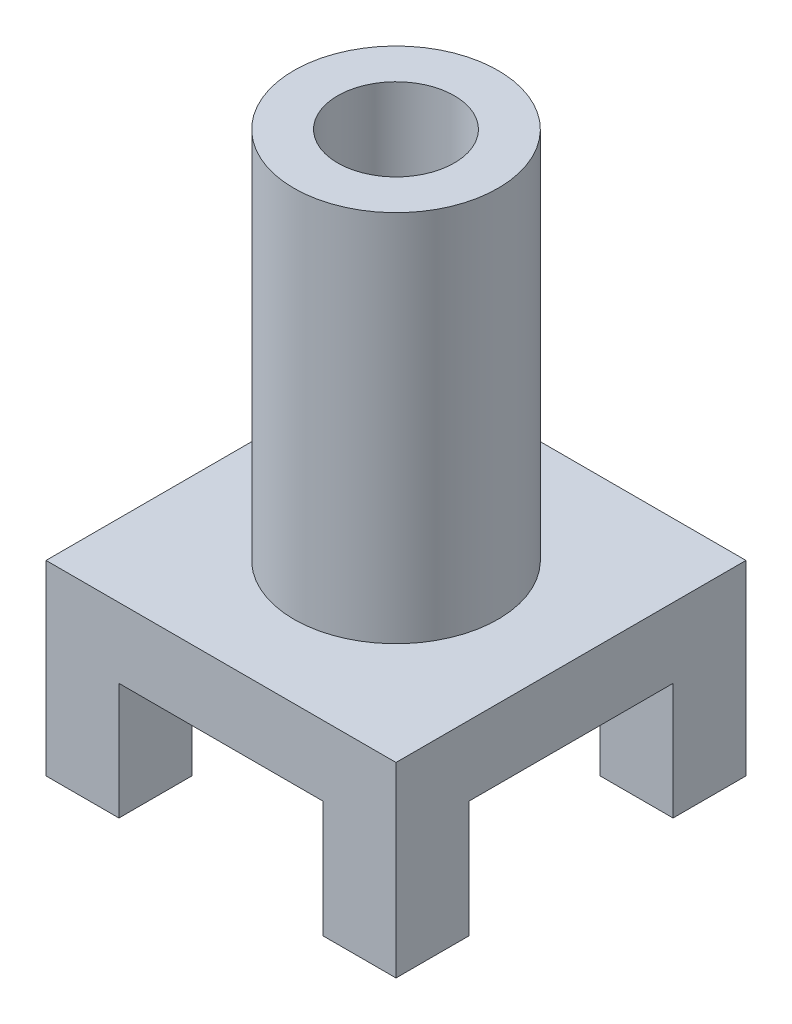
from build123d import *

# Parameters (mm, degrees)
SKETCH1_W           = 60
SKETCH1_H           = 60
BOSS_EXTRUDE1_DEPTH = 32
SKETCH2_W           = 35
SKETCH2_H           = 20
CUT_EXTRUDE2_DEPTH  = 75.323616704
SKETCH4_W           = 35
SKETCH4_H           = 20
CUT_EXTRUDE3_DEPTH  = 75.323616704
SKETCH5_R           = 17.5
BOSS_EXTRUDE2_DEPTH = 64
SKETCH6_R           = 10
CUT_EXTRUDE4_DEPTH  = 105.957134107


with BuildPart() as part:
    # Sketch1 → Boss-Extrude1 (new body)
    with BuildSketch(Plane(origin=(0, 0, 0), x_dir=(1, 0, 0), z_dir=(0, 1, 0))):
        Rectangle(SKETCH1_W, SKETCH1_H)
    extrude(amount=BOSS_EXTRUDE1_DEPTH)

    # Sketch2 → Cut-Extrude2 (cut, through all)
    with BuildSketch(Plane(origin=(30, 0, 0), x_dir=(0, 0, -1), z_dir=(1, 0, 0))):
        with Locations((0, 10)):
            Rectangle(SKETCH2_W, SKETCH2_H)
    extrude(amount=-CUT_EXTRUDE2_DEPTH, mode=Mode.SUBTRACT)

    # Sketch4 → Cut-Extrude3 (cut, through all)
    with BuildSketch(Plane.XY.offset(30)):
        with Locations((0, 10)):
            Rectangle(SKETCH4_W, SKETCH4_H)
    extrude(amount=-CUT_EXTRUDE3_DEPTH, mode=Mode.SUBTRACT)

    # Sketch5 → Boss-Extrude2 (add)
    with BuildSketch(Plane(origin=(0, 32, 0), x_dir=(1, 0, 0), z_dir=(0, 1, 0))):
        with Locations(Location((0, 0, 0), (0, 0, 270))):
            Circle(SKETCH5_R)
    extrude(amount=BOSS_EXTRUDE2_DEPTH)

    # Sketch6 → Cut-Extrude4 (cut, through all)
    with BuildSketch(Plane(origin=(0, 96, 0), x_dir=(1, 0, 0), z_dir=(0, 1, 0))):
        with Locations(Location((0, 0, 0), (0, 0, 270))):
            Circle(SKETCH6_R)
    extrude(amount=-CUT_EXTRUDE4_DEPTH, mode=Mode.SUBTRACT)


solid = part.part
